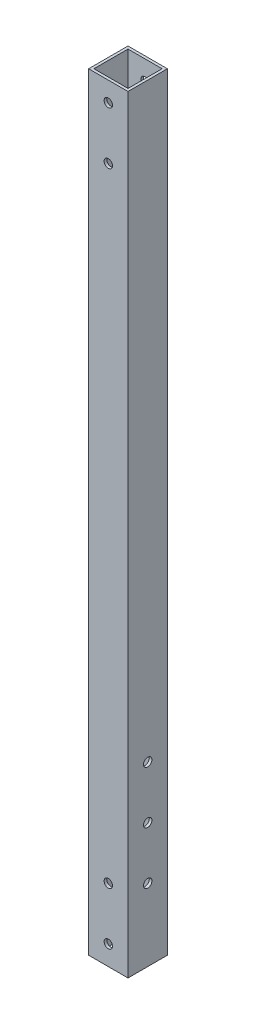
from build123d import *

# Parameters (mm, degrees)
SKETCH_1_W          = 15
SKETCH_1_H          = 15
SKETCH_1_W_2        = 13
SKETCH_1_H_2        = 13
EXTRUDE_1_DEPTH     = 292.5
SKETCH_2_R          = 1.6
CUT_EXTRUDE_1_DEPTH = 293.980374769
SKETCH_3_R          = 1.6
CUT_EXTRUDE_2_DEPTH = 293.980374769


with BuildPart() as part:
    # 草图1 → 拉伸-薄壁1 (new body)
    with BuildSketch(Plane(origin=(0, 0, 0), x_dir=(1, 0, 0), z_dir=(0, 1, 0))):
        Rectangle(SKETCH_1_W, SKETCH_1_H)
        Rectangle(SKETCH_1_W_2, SKETCH_1_H_2, mode=Mode.SUBTRACT)
    extrude(amount=EXTRUDE_1_DEPTH)

    # 草图2 → 切除-拉伸1 (cut, through all)
    with BuildSketch(Plane.XY.offset(7.5)):
        with Locations((0, 7.5)):
            Circle(SKETCH_2_R)
        with Locations((0, 27.5)):
            Circle(SKETCH_2_R)
        with Locations(Location((0, 265, 0), (0, 0, 180))):
            Circle(SKETCH_2_R)
        with Locations(Location((0, 285, 0), (0, 0, 180))):
            Circle(SKETCH_2_R)
    extrude(amount=-CUT_EXTRUDE_1_DEPTH, mode=Mode.SUBTRACT)

    # 草图3 → 切除-拉伸2 (cut, through all)
    with BuildSketch(Plane(origin=(7.5, 0, 0), x_dir=(0, 0, -1), z_dir=(1, 0, 0))):
        with Locations((0, 27.5)):
            Circle(SKETCH_3_R)
        with Locations((0, 47.5)):
            Circle(SKETCH_3_R)
        with Locations((0, 67.5)):
            Circle(SKETCH_3_R)
    extrude(amount=-CUT_EXTRUDE_2_DEPTH, mode=Mode.SUBTRACT)


solid = part.part
